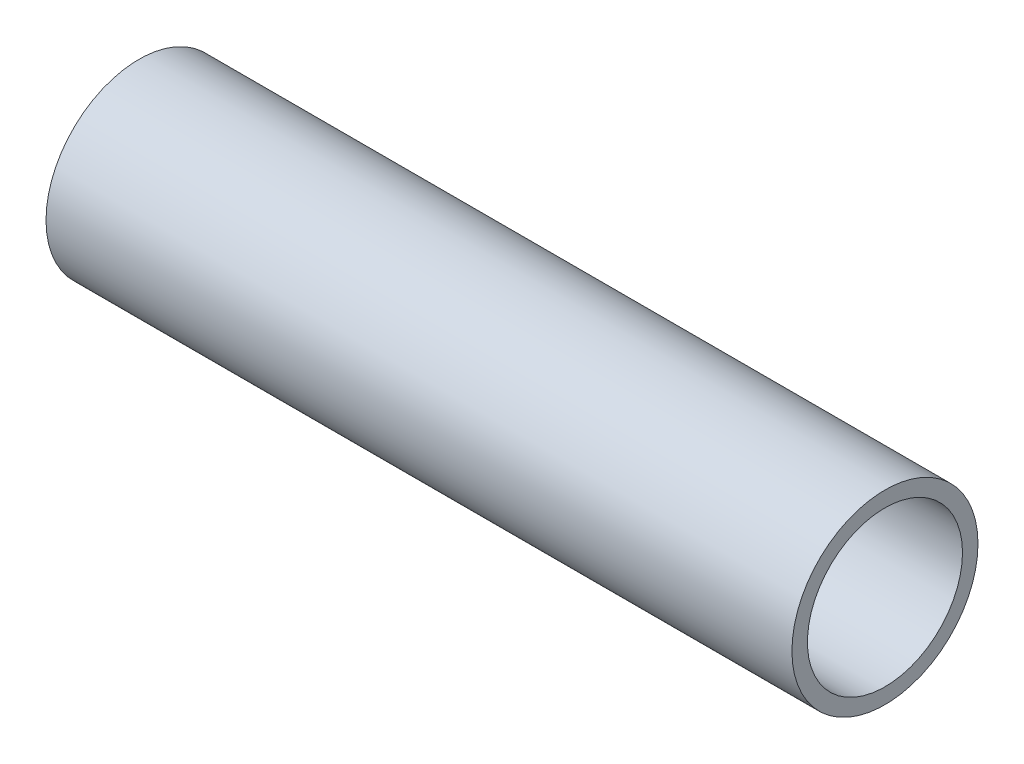
from build123d import *

# Parameters (mm, degrees)
SKETCH1_R           = 12
SKETCH1_R_2         = 10
BOSS_EXTRUDE1_DEPTH = 96.21


with BuildPart() as part:
    # Sketch1 → Boss-Extrude1 (new body)
    with BuildSketch(Plane(origin=(0, 0, 0), x_dir=(0, 0, -1), z_dir=(1, 0, 0))):
        Circle(SKETCH1_R)
        Circle(SKETCH1_R_2, mode=Mode.SUBTRACT)
    extrude(amount=BOSS_EXTRUDE1_DEPTH)


solid = part.part
